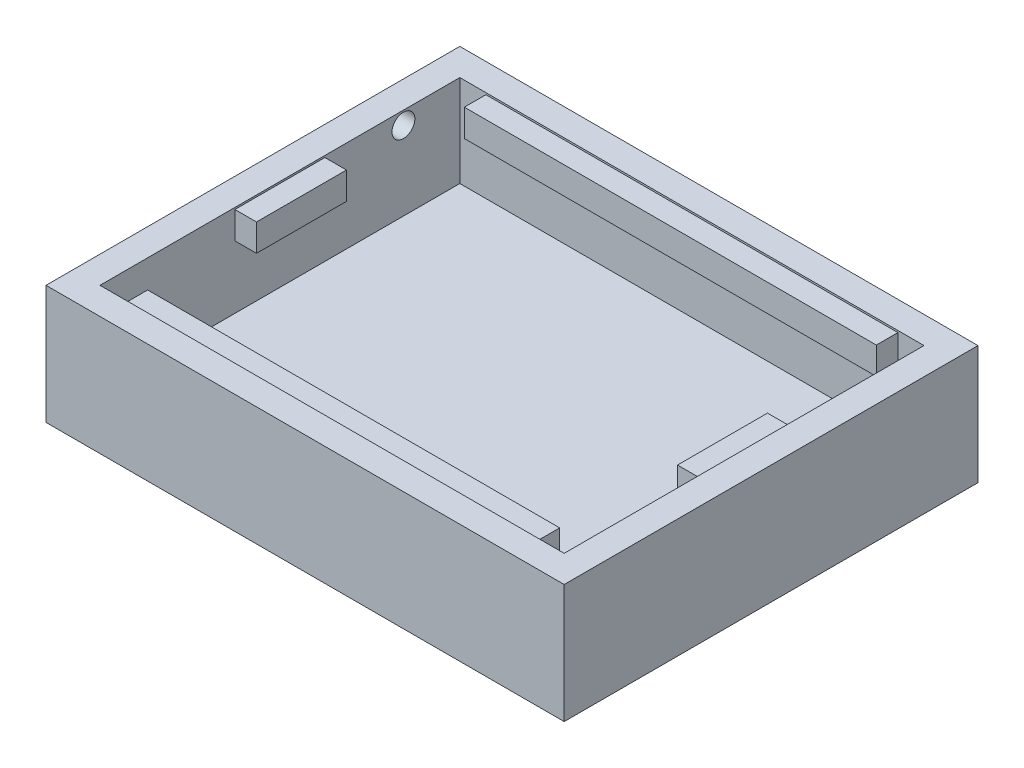
from build123d import *

# Parameters (mm, degrees)
SKETCH1_W           = 288
SKETCH1_H           = 230
SKETCH1_W_2         = 258
SKETCH1_H_2         = 200
WALLS_DEPTH         = 51
SKETCH3_W           = 288
SKETCH3_H           = 230
BASE_DEPTH          = 15
SKETCH4_W           = 12
SKETCH4_H           = 15.1
LONG_SUPPORT_DEPTH  = 114.5
SKETCH5_W           = 12
SKETCH5_H           = 15.1
SHORT_SUPPORT_DEPTH = 25
CUT_EXTRUDE4_REACH  = 353.219
SKETCH6_R           = 6.35


with BuildPart() as part:
    # Sketch1 → Walls (new body)
    with BuildSketch(Plane(origin=(0, 0, 0), x_dir=(1, 0, 0), z_dir=(0, 1, 0))):
        with Locations((129, 100)):
            Rectangle(SKETCH1_W, SKETCH1_H)
        with Locations((129, 100)):
            Rectangle(SKETCH1_W_2, SKETCH1_H_2, mode=Mode.SUBTRACT)
    extrude(amount=WALLS_DEPTH)

    # Sketch3 → Base (add)
    with BuildSketch(Plane.XZ):
        with Locations((129, -100)):
            Rectangle(SKETCH3_W, SKETCH3_H)
    extrude(amount=BASE_DEPTH)

    # Sketch4 → Long_Support (add, symmetric)
    with BuildSketch(Plane(origin=(129, 0, 0), x_dir=(0, 0, -1), z_dir=(1, 0, 0))):
        with Locations((6, 42.45)):
            Rectangle(SKETCH4_W, SKETCH4_H)
        with Locations((194, 42.45)):
            Rectangle(SKETCH4_W, SKETCH4_H)
    extrude(amount=LONG_SUPPORT_DEPTH, both=True)

    # Sketch5 → Short_Support (add, symmetric)
    with BuildSketch(Plane(origin=(0, 0, -100), x_dir=(-1, 0, 0), z_dir=(0, 0, -1))):
        with Locations((-252, 42.45)):
            Rectangle(SKETCH5_W, SKETCH5_H)
        with Locations((-6, 42.45)):
            Rectangle(SKETCH5_W, SKETCH5_H)
    extrude(amount=SHORT_SUPPORT_DEPTH, both=True)

    # Sketch6 → Cut-Extrude4 (cut, up to next)
    with BuildSketch(Plane(origin=(0, 0, 0), x_dir=(0, 0, -1), z_dir=(1, 0, 0)), mode=Mode.PRIVATE) as cut_extrude4_sk1:
        with Locations((168.65, 43.65)):
            Circle(SKETCH6_R)
    cut_extrude4_tool1 = extrude(cut_extrude4_sk1.sketch, amount=-CUT_EXTRUDE4_REACH, mode=Mode.PRIVATE) & part.part
    add(cut_extrude4_tool1.solids().sort_by_distance((0, 43.65, -168.65))[0], mode=Mode.SUBTRACT)


solid = part.part
